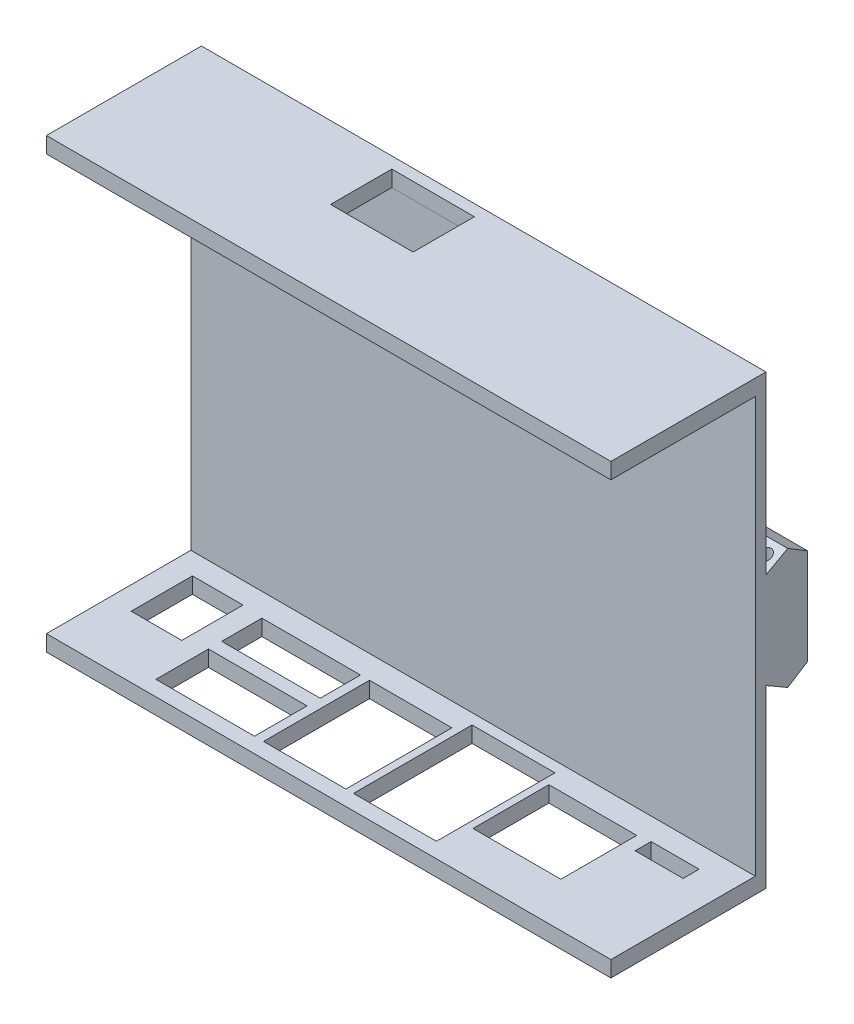
from build123d import *

# Parameters (mm, degrees)
SKETCH1_W               = 105.991744741
SKETCH1_H               = 29.109935465
BOSS_EXTRUDE1_DEPTH     = 84
CUT_EXTRUDE1_DEPTH      = 199.997997189
CUT_EXTRUDE1_DEPTH_BACK = 3
SKETCH3_W               = 15.49999237
SKETCH3_H               = 11.5
CUT_EXTRUDE2_DEPTH      = 139.309528443
CUT_EXTRUDE2_DEPTH_BACK = 139.309528443
SKETCH4_W               = 27.109935465
SKETCH4_H               = 78
SKETCH5_W               = 9.5
SKETCH5_H               = 11.499607086
SKETCH5_W_2             = 18.49999237
SKETCH5_H_2             = 9.868988037
SKETCH5_H_3             = 7.550139481
SKETCH5_W_3             = 15.472055618
SKETCH5_H_4             = 19.899999618
SKETCH5_W_4             = 15.574996948
SKETCH5_H_5             = 22.25664711
SKETCH5_W_5             = 16.499984741
SKETCH5_H_6             = 14.249998093
SKETCH5_W_6             = 9
SKETCH5_H_7             = 3
CUT_EXTRUDE3_DEPTH      = 3
BOSS_EXTRUDE2_DEPTH     = 105.991744742
SKETCH7_R               = 1
CUT_EXTRUDE4_DEPTH      = 199.99799719
LPATTERN1_COUNT         = 28
LPATTERN1_PITCH         = 3.71


with BuildPart() as part:
    # Sketch1 → Boss-Extrude1 (new body)
    with BuildSketch(Plane(origin=(0, 0, 0), x_dir=(1, 0, 0), z_dir=(0, 1, 0))):
        with Locations((125.062902141, -14.415287787)):
            Rectangle(SKETCH1_W, SKETCH1_H)
    extrude(amount=BOSS_EXTRUDE1_DEPTH)

    # Sketch3 → Cut-Extrude1 (cut, two sides: drawn at the far end of the back side and taken through both)
    with BuildSketch(Plane(origin=(0, 84, 0), x_dir=(1, 0, 0), z_dir=(0, 1, 0)).offset(-CUT_EXTRUDE1_DEPTH_BACK)):
        with Locations((117.700000763, -7.750003815)):
            Rectangle(SKETCH3_W, SKETCH3_H)
    extrude(amount=CUT_EXTRUDE1_DEPTH + CUT_EXTRUDE1_DEPTH_BACK, mode=Mode.SUBTRACT)

    # Sketch4 → Cut-Extrude2 (cut, two sides: drawn at the far end of the back side and taken through both)
    with BuildSketch(Plane.ZY.offset(-72.06702977).offset(-CUT_EXTRUDE2_DEPTH_BACK)):
        with Locations((15.415287787, 42)):
            Rectangle(SKETCH4_W, SKETCH4_H)
    extrude(amount=CUT_EXTRUDE2_DEPTH + CUT_EXTRUDE2_DEPTH_BACK, mode=Mode.SUBTRACT)

    # Sketch5 → Cut-Extrude3 (cut)
    with BuildSketch(Plane.XZ):
        with Locations((81.127942856, 11.617159806)):
            Rectangle(SKETCH5_W, SKETCH5_H)
        with Locations((99.027940567, 21.182469331)):
            Rectangle(SKETCH5_W_2, SKETCH5_H_2)
        with Locations((99.027940567, 9.992033472)):
            Rectangle(SKETCH5_W_2, SKETCH5_H_3)
        with Locations((117.713969139, 16.16696354)):
            Rectangle(SKETCH5_W_3, SKETCH5_H_4)
        with Locations((134.662498474, 14.988639794)):
            Rectangle(SKETCH5_W_4, SKETCH5_H_5)
        with Locations((152.049995423, 13.481646538)):
            Rectangle(SKETCH5_W_5, SKETCH5_H_6)
        with Locations((167.149993896, 7.507040024)):
            Rectangle(SKETCH5_W_6, SKETCH5_H_7)
    extrude(amount=-CUT_EXTRUDE3_DEPTH, mode=Mode.SUBTRACT)

    # Sketch6 → Boss-Extrude2 (add)
    with BuildSketch(Plane.ZY.offset(-72.06702977)):
        Polygon((-0.139679946, 33), (-0.139679946, 51), (-4.229633498, 53.254147276), (-7.960635886, 51), (-7.960635886, 33), (-4.229633498, 30.638664216), align=None)
    extrude(amount=-BOSS_EXTRUDE2_DEPTH)

    # Sketch7 → Cut-Extrude4 (cut, symmetric)
    with BuildSketch(Plane(origin=(0, 0, 0), x_dir=(1, 0, 0), z_dir=(0, 1, 0))):
        with Locations(Location((75.77702977, 2.239679946, 0), (0, 0, 90))):
            Circle(SKETCH7_R)
    cut_extrude4 = extrude(amount=CUT_EXTRUDE4_DEPTH, both=True, mode=Mode.SUBTRACT)

    # LPattern1: Cut-Extrude4 ×28
    with Locations(*[(i * LPATTERN1_PITCH, 0, 0) for i in range(1, LPATTERN1_COUNT)]):
        add(cut_extrude4, mode=Mode.SUBTRACT)


solid = part.part
